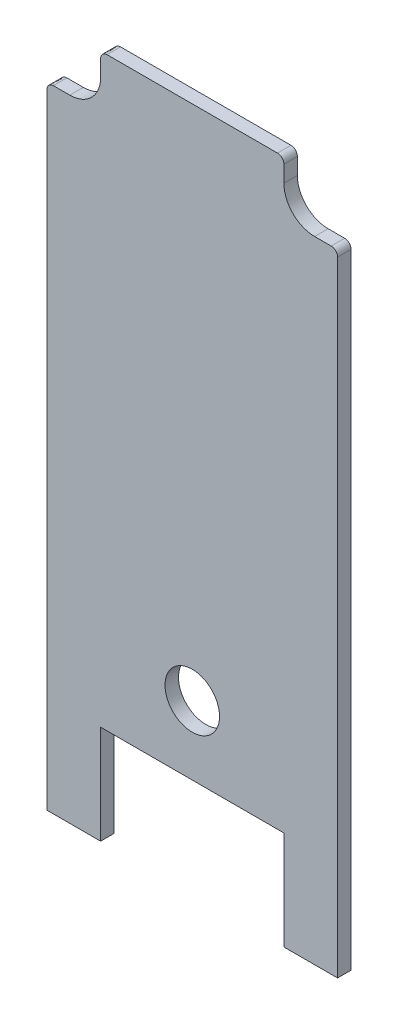
from build123d import *

# Parameters (mm, degrees)
SKETCH2_R           = 3.175
BOSS_EXTRUDE1_DEPTH = 1.57


with BuildPart() as part:
    # Sketch2 → Boss-Extrude1 (new body)
    with BuildSketch(Plane.XY.offset(5)):
        with BuildLine():
            Line((-16.920508995, 36.97485167), (-16.920508995, -35.724508995))
            Line((-16.920508995, -35.724508995), (-10.670508995, -35.724508995))
            Line((-10.670508995, -35.724508995), (-10.670508995, -24.224508995))
            Line((-10.670508995, -24.224508995), (10.670508995, -24.224508995))
            Line((10.670508995, -24.224508995), (10.670508995, -35.724508995))
            Line((10.670508995, -35.724508995), (16.920508995, -35.724508995))
            Line((16.920508995, -35.724508995), (16.920508995, 36.97485167))
            add(Edge.make_bspline(
                [(16.17485167, 37.720508995), (16.268017422, 37.720508995), (16.450238191, 37.688464247), (16.71855323, 37.51855323), (16.888464247, 37.250238191), (16.920508995, 37.068017422), (16.920508995, 36.97485167)],
                knots=[0, 0, 0, 0, 0.25, 0.5, 0.75, 1, 1, 1, 1], degree=3))
            Line((16.17485167, 37.720508995), (14.25, 37.720508995))
            ThreePointArc((14.25, 37.720508995), (11.718917637, 38.768917637), (10.670508995, 41.3))
            Line((10.670508995, 41.3), (10.670508995, 43.22485167))
            add(Edge.make_bspline(
                [(9.92485167, 43.970508995), (10.018017422, 43.970508995), (10.200238191, 43.938464247), (10.46855323, 43.76855323), (10.638464247, 43.500238191), (10.670508995, 43.318017422), (10.670508995, 43.22485167)],
                knots=[0, 0, 0, 0, 0.25, 0.5, 0.75, 1, 1, 1, 1], degree=3))
            Line((9.92485167, 43.970508995), (-9.92485167, 43.970508995))
            add(Edge.make_bspline(
                [(-10.670508995, 43.22485167), (-10.670508995, 43.318017422), (-10.638464247, 43.500238191), (-10.46855323, 43.76855323), (-10.200238191, 43.938464247), (-10.018017422, 43.970508995), (-9.92485167, 43.970508995)],
                knots=[0, 0, 0, 0, 0.25, 0.5, 0.75, 1, 1, 1, 1], degree=3))
            Line((-10.670508995, 43.22485167), (-10.670508995, 41.3))
            ThreePointArc((-10.670508995, 41.3), (-11.718917637, 38.768917637), (-14.25, 37.720508995))
            Line((-14.25, 37.720508995), (-16.17485167, 37.720508995))
            add(Edge.make_bspline(
                [(-16.920508995, 36.97485167), (-16.920508995, 37.068017422), (-16.888464247, 37.250238191), (-16.71855323, 37.51855323), (-16.450238191, 37.688464247), (-16.268017422, 37.720508995), (-16.17485167, 37.720508995)],
                knots=[0, 0, 0, 0, 0.25, 0.5, 0.75, 1, 1, 1, 1], degree=3))
        make_face()
        with Locations((0, -16.224508995)):
            Circle(SKETCH2_R, mode=Mode.SUBTRACT)
    extrude(amount=BOSS_EXTRUDE1_DEPTH)


solid = part.part
